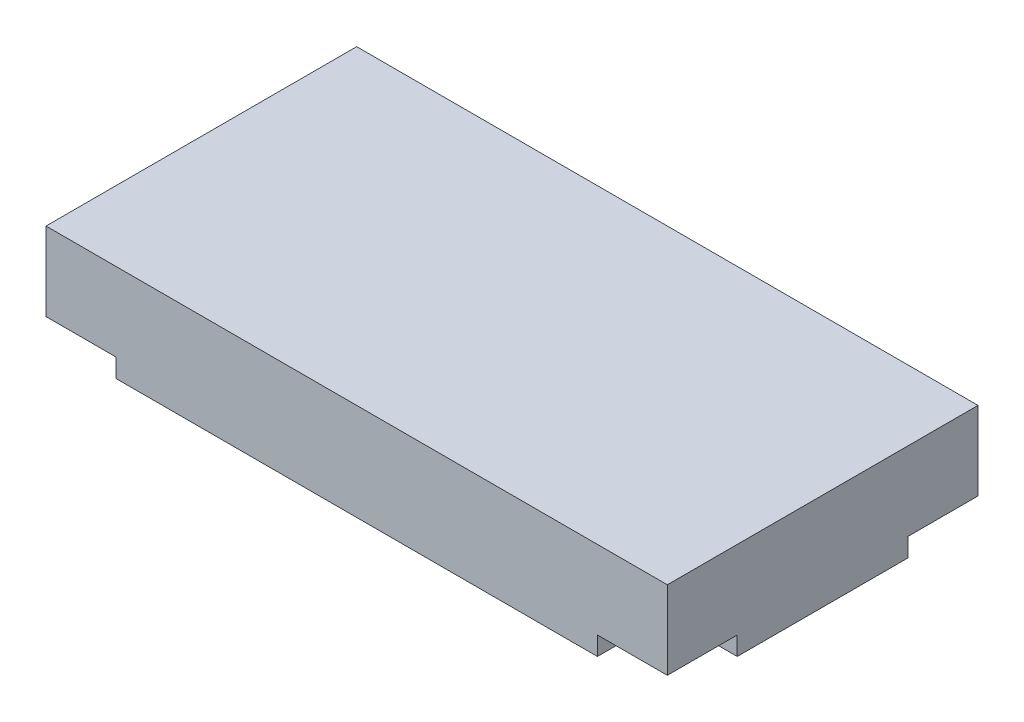
from build123d import *

# Parameters (mm, degrees)
CROQUIS_BASE_W          = 40
CROQUIS_BASE_H          = 20
SALIENTE_EXTRUIR1_DEPTH = 6.25
CORTAR_EXTRUIR1_DEPTH   = 1.2


with BuildPart() as part:
    # Croquis base → Saliente-Extruir1 (new body)
    with BuildSketch(Plane(origin=(0, 0, 0), x_dir=(1, 0, 0), z_dir=(0, 1, 0))):
        Rectangle(CROQUIS_BASE_W, CROQUIS_BASE_H)
    extrude(amount=SALIENTE_EXTRUIR1_DEPTH)

    # Croquis base detalles → Cortar-Extruir1 (cut)
    with BuildSketch(Plane.XZ):
        with BuildLine():
            Line((15.5, 10), (15.5, 7.75))
            ThreePointArc((15.5, 7.75), (16.159009742, 6.159009742), (17.75, 5.5))
            Line((17.75, 5.5), (20, 5.5))
            Line((20, 5.5), (20, 10))
            Line((20, 10), (15.5, 10))
        make_face()
        with BuildLine():
            Line((-20, 10), (-15.5, 10))
            Line((-15.5, 10), (-15.5, 7.75))
            ThreePointArc((-15.5, 7.75), (-16.159009742, 6.159009742), (-17.75, 5.5))
            Line((-17.75, 5.5), (-20, 5.5))
            Line((-20, 5.5), (-20, 10))
        make_face()
        with BuildLine():
            Line((20, -10), (15.5, -10))
            Line((15.5, -10), (15.5, -7.75))
            ThreePointArc((15.5, -7.75), (16.159009742, -6.159009742), (17.75, -5.5))
            Line((17.75, -5.5), (20, -5.5))
            Line((20, -5.5), (20, -10))
        make_face()
        with BuildLine():
            Line((-15.5, -10), (-15.5, -7.75))
            ThreePointArc((-15.5, -7.75), (-16.159009742, -6.159009742), (-17.75, -5.5))
            Line((-17.75, -5.5), (-20, -5.5))
            Line((-20, -5.5), (-20, -10))
            Line((-20, -10), (-15.5, -10))
        make_face()
    extrude(amount=-CORTAR_EXTRUIR1_DEPTH, mode=Mode.SUBTRACT)


solid = part.part
